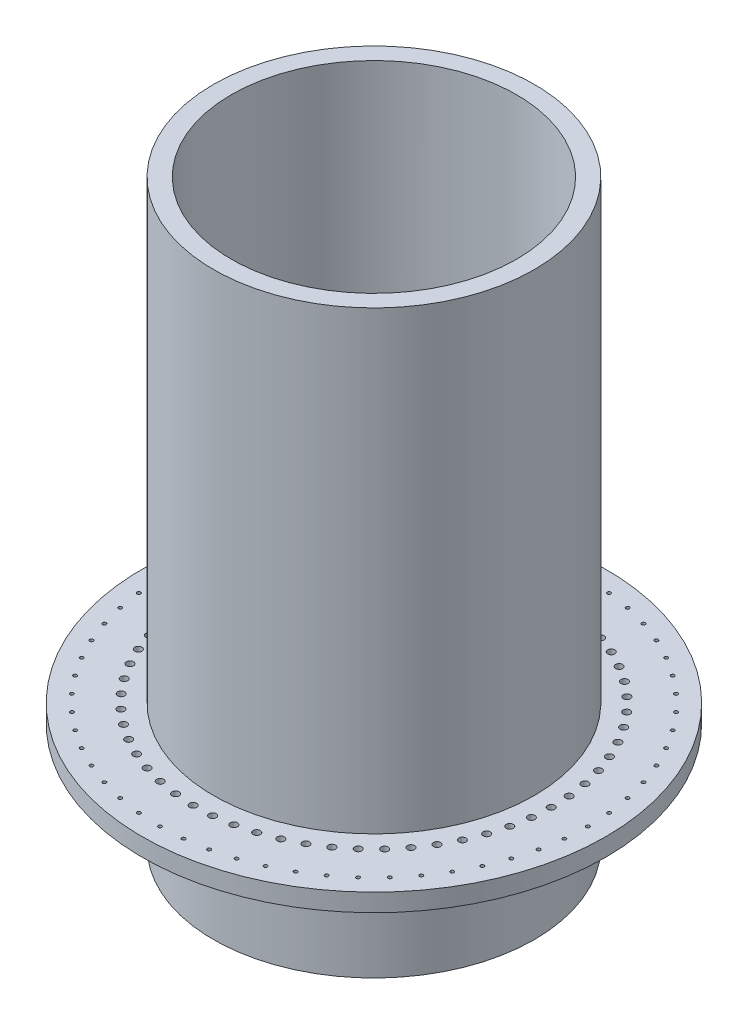
from build123d import *

# Parameters (mm, degrees)
CUT_EXTRUDE1_START = -10
CUT_EXTRUDE1_DEPTH = 10
SKETCH4_R          = 0.5
SKETCH4_R_2        = 0.25
CUT_EXTRUDE2_DEPTH = 10
CIRPATTERN1_COUNT  = 15


with BuildPart() as part:
    # Sketch1 → Revolve1 (revolve)
    with BuildSketch(Plane.XY, mode=Mode.PRIVATE) as revolve1_sk:
        Polygon((-20, 2.5), (-20, 80), (-20, 81.381966), (-22.5, 81.381966), (-22.5, 17.5), (-32.5, 17.5), (-32.5, 15), (-22.5, 15), (-22.5, 0), (-20, 0), (-11.545085, 0), (-7.236068, -8.618034), (-5, -8.618034), (-5, -7.5), (-10, 2.5), align=None)
        Polygon((20, 80), (20, 0), (22.5, 0), (22.5, 15), (32.5, 15), (32.5, 17.5), (22.5, 17.5), (22.5, 81.381966), (20, 81.381966), align=None)
    revolve(revolve1_sk.sketch.rotate(Axis((0, -777.658177, 0), (0, 1, 0)), 180), axis=Axis((0, -777.658177, 0), (0, 1, 0)))

    # Sketch3 → Cut-Extrude1 (cut)
    with BuildSketch(Plane.XZ.offset(CUT_EXTRUDE1_START)):
        with BuildLine():
            Line((-19.960899, 1.25), (-13.98935, 1.25))
            ThreePointArc((-13.98935, 1.25), (-9.931375, 9.931375), (-1.25, 13.98935))
            Line((-1.25, 13.98935), (-1.25, 19.960899))
            ThreePointArc((-1.25, 19.960899), (-14.142136, 14.142136), (-19.960899, 1.25))
        make_face()
        with BuildLine():
            Line((19.960899, 1.25), (13.98935, 1.25))
            ThreePointArc((13.98935, 1.25), (9.931375, 9.931375), (1.25, 13.98935))
            Line((1.25, 13.98935), (1.25, 19.960899))
            ThreePointArc((1.25, 19.960899), (14.142136, 14.142136), (19.960899, 1.25))
        make_face()
        with BuildLine():
            Line((19.960899, -1.25), (13.98935, -1.25))
            ThreePointArc((13.98935, -1.25), (9.931375, -9.931375), (1.25, -13.98935))
            Line((1.25, -13.98935), (1.25, -19.960899))
            ThreePointArc((1.25, -19.960899), (14.142136, -14.142136), (19.960899, -1.25))
        make_face()
        with BuildLine():
            Line((-19.960899, -1.25), (-13.98935, -1.25))
            ThreePointArc((-13.98935, -1.25), (-9.931375, -9.931375), (-1.25, -13.98935))
            Line((-1.25, -13.98935), (-1.25, -19.960899))
            ThreePointArc((-1.25, -19.960899), (-14.142136, -14.142136), (-19.960899, -1.25))
        make_face()
    extrude(amount=CUT_EXTRUDE1_DEPTH, mode=Mode.SUBTRACT)

    # Sketch4 → Cut-Extrude2 (cut)
    with BuildSketch(Plane.XZ.offset(-15)):
        with Locations((25, -2.378506)):
            Circle(SKETCH4_R)
        with Locations((-30, 0)):
            Circle(SKETCH4_R_2)
        with Locations((-25, 2.378506)):
            Circle(SKETCH4_R)
        with Locations((2.378506, 25)):
            Circle(SKETCH4_R)
        with Locations((0, 30)):
            Circle(SKETCH4_R_2)
        with Locations((30, 0)):
            Circle(SKETCH4_R_2)
        with Locations((0, -30)):
            Circle(SKETCH4_R_2)
        with Locations((-2.378506, -25)):
            Circle(SKETCH4_R)
    cut_extrude2 = extrude(amount=-CUT_EXTRUDE2_DEPTH, mode=Mode.SUBTRACT)

    # CirPattern1: Cut-Extrude2 ×15 about axis
    cirpattern1_axis = Axis((0, 0, 0), (0, 1, 0))
    for i in range(1, CIRPATTERN1_COUNT):
        add(cut_extrude2.rotate(cirpattern1_axis, i * 360 / CIRPATTERN1_COUNT), mode=Mode.SUBTRACT)


solid = part.part
